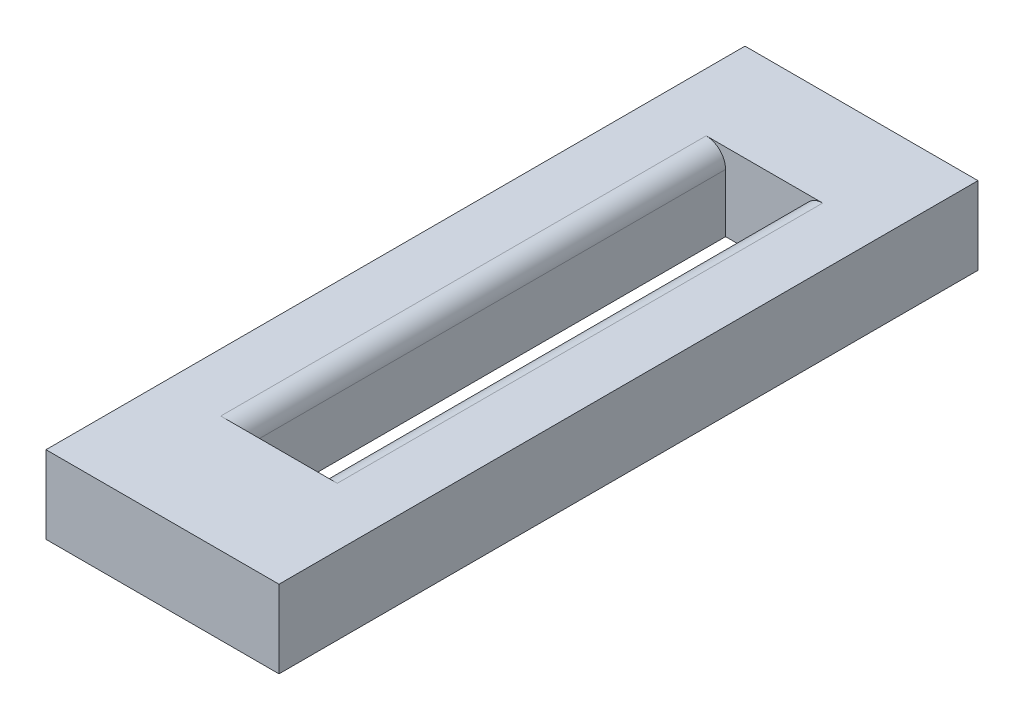
from build123d import *

# Parameters (mm, degrees)
SKETCH_2_W          = 60
SKETCH_2_H          = 20
EXTRUDE_1_DEPTH     = 180
SKETCH_14_W         = 20
SKETCH_14_H         = 125
CUT_EXTRUDE_1_DEPTH = 184.575597507
FILLET_1_R          = 5


with BuildPart() as part:
    # 草圖2 → 填料-伸長1 (new body)
    with BuildSketch(Plane.XY):
        Rectangle(SKETCH_2_W, SKETCH_2_H)
    extrude(amount=-EXTRUDE_1_DEPTH)

    # 草圖14 → 除料-伸長1 (cut, through all)
    with BuildSketch(Plane(origin=(0, 10, 0), x_dir=(1, 0, 0), z_dir=(0, 1, 0))):
        with Locations((0, 92.5)):
            Rectangle(SKETCH_14_W, SKETCH_14_H)
    extrude(amount=-CUT_EXTRUDE_1_DEPTH, mode=Mode.SUBTRACT)

    # 圓角1
    fillet_1_edges = [part.edges().sort_by_distance(p)[0] for p in [
        (10, 10, -92.5),
        (-10, 10, -92.5),
    ]]
    fillet(fillet_1_edges, radius=FILLET_1_R)


solid = part.part
